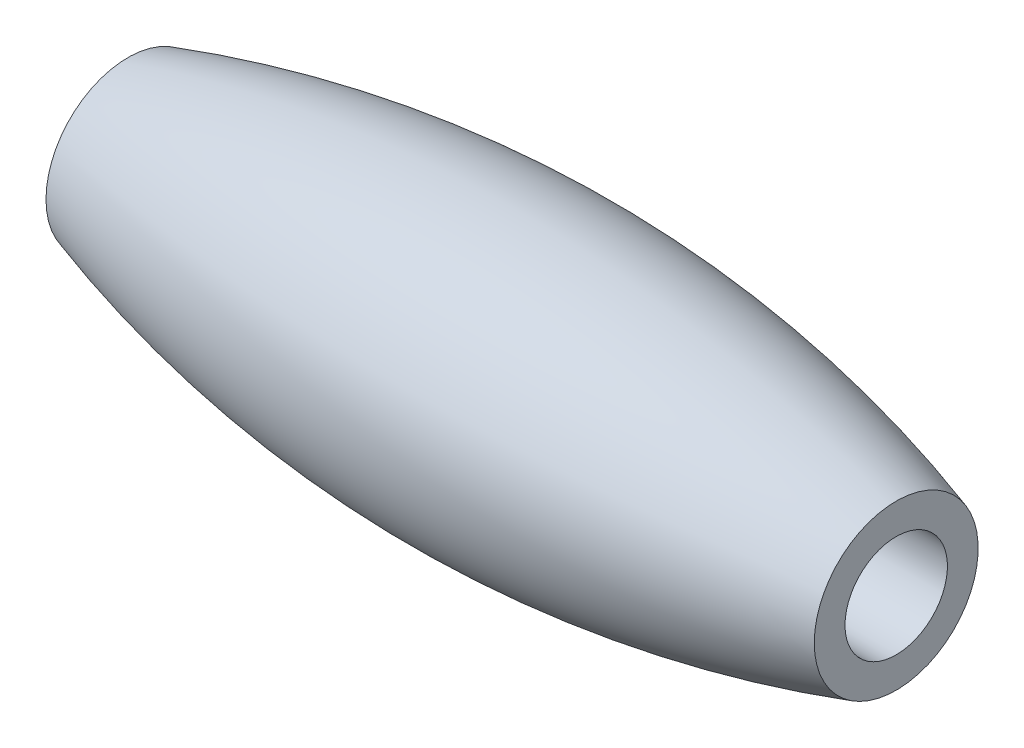
from build123d import *


with BuildPart() as part:
    # ｽｹｯﾁ1 → 回転1 (revolve)
    with BuildSketch(Plane.XY, mode=Mode.PRIVATE) as revolve_1_sk:
        with BuildLine():
            Line((-15, 3.2), (-15, 2))
            Line((-15, 2), (15, 2))
            Line((15, 2), (15, 3.2))
            ThreePointArc((15, 3.2), (0, 5.503039929), (-15, 3.2))
        make_face()
    revolve(revolve_1_sk.sketch.rotate(Axis((-15, 0, 0), (1, 0, 0)), 90), axis=Axis((-15, 0, 0), (1, 0, 0)))


solid = part.part
